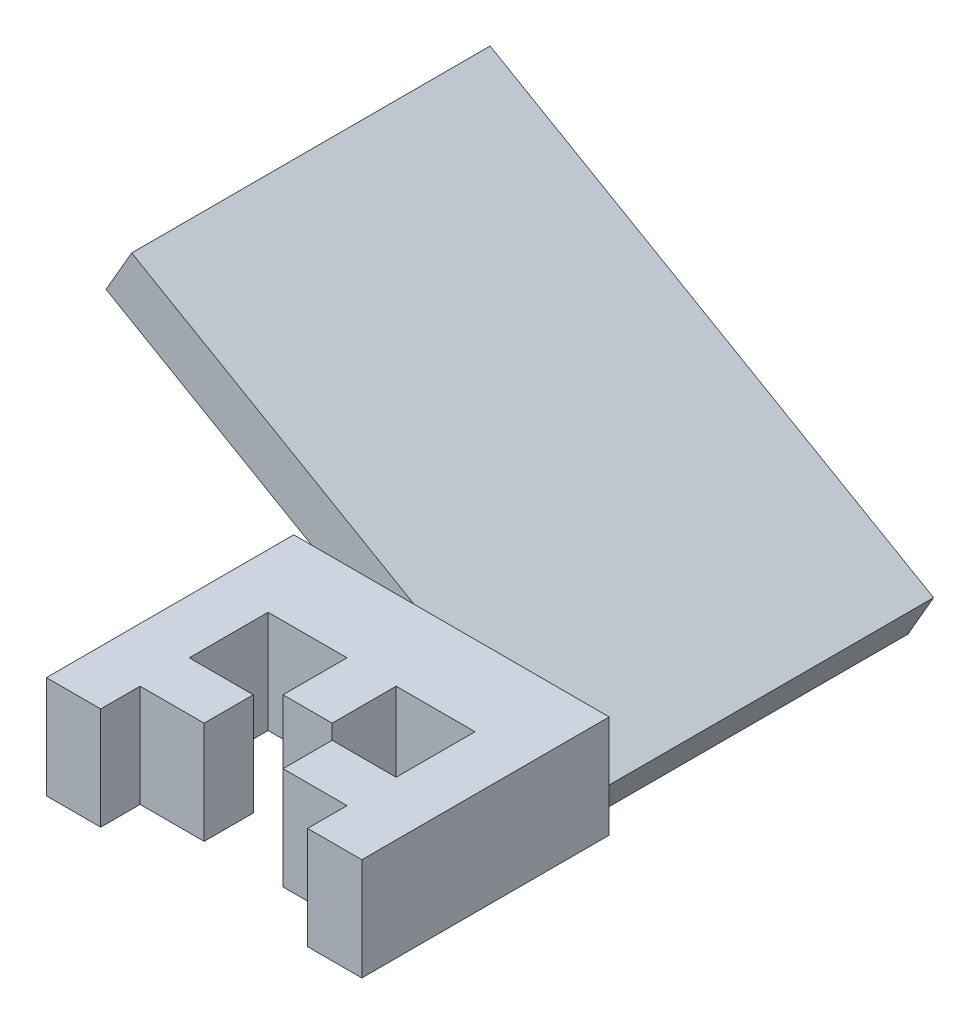
from build123d import *

# Parameters (mm, degrees)
BOSS_EXTRU_1_DEPTH = 5
ESQUISSE14_W       = 30.8
ESQUISSE14_H       = 2.5
BOSS_EXTRU_3_DEPTH = 10
BOSS_EXTRU_5_DEPTH = 35


with BuildPart() as part:
    # Base → Boss.-Extru.1 (new, symmetric)
    with BuildSketch(Plane(origin=(0, 0, 0), x_dir=(1, 0, 0), z_dir=(0, 1, 0))):
        Polygon((-3.85, -2.4), (-3.85, 2.4), (-10.1, 2.4), (-10.1, 10.1), (-2.4, 10.1), (-2.4, 3.85), (2.4, 3.85), (2.4, 10.1), (10.1, 10.1), (10.1, 2.4), (3.85, 2.4), (3.85, -2.4), (10.1, -2.4), (10.1, -6.25), (15.4, -6.25), (15.4, 15.4), (-15.4, 15.4), (-15.4, -6.25), (-10.1, -6.25), (-10.1, -2.4), align=None)
    extrude(amount=BOSS_EXTRU_1_DEPTH, both=True)

    # Esquisse14 → Boss.-Extru.3 (add)
    with BuildSketch(Plane.XZ.offset(5)):
        with Locations((0, -16.65)):
            Rectangle(ESQUISSE14_W, ESQUISSE14_H)
    extrude(amount=-BOSS_EXTRU_3_DEPTH)

    # Esquisse16 → Boss.-Extru.5 (add)
    with BuildSketch(Plane(origin=(0, 0, -17.9), x_dir=(-1, 0, 0), z_dir=(0, 0, -1))):
        Polygon((31.226270189, 20.920127019), (33.726270189, 16.59), (-9.575, -8.41), (-12.075, -4.079872981), align=None)
    extrude(amount=BOSS_EXTRU_5_DEPTH)


solid = part.part
